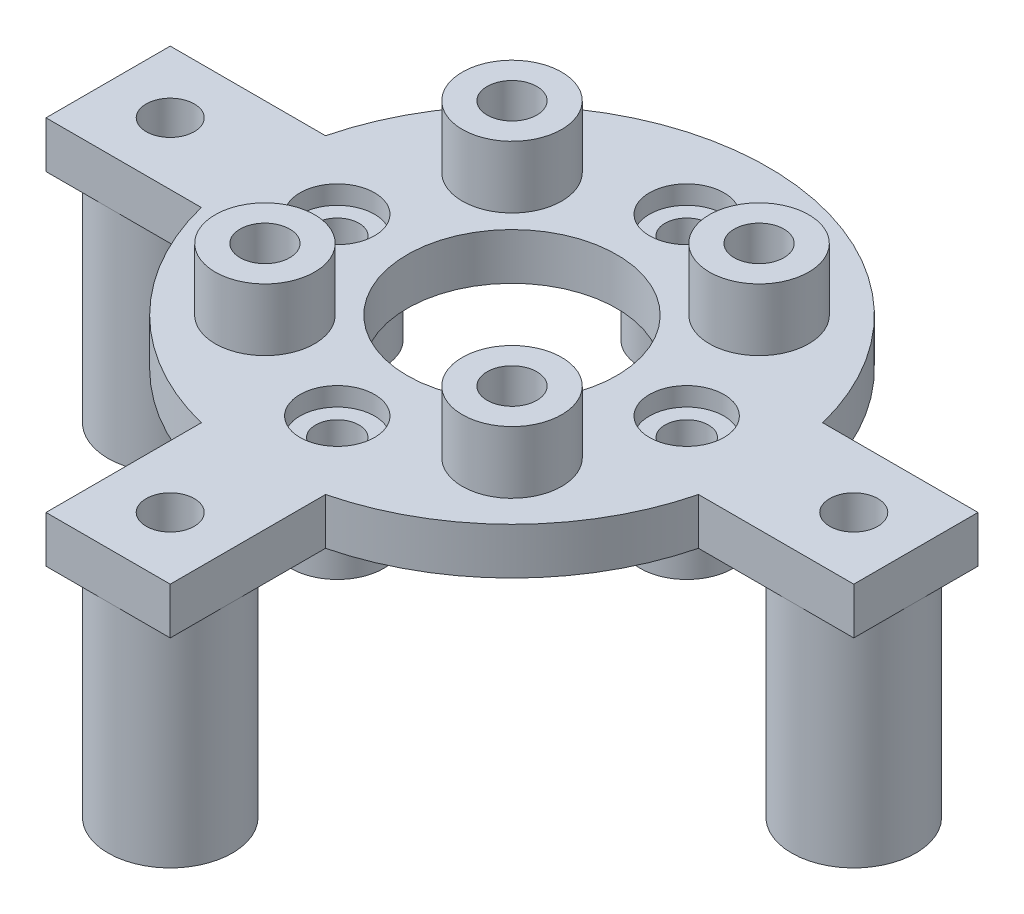
from build123d import *
from build123d.topology import SkipClean

# Parameters (mm, degrees)
SKETCH_1_R          = 16.5
SKETCH_1_R_2        = 1.4
SKETCH_1_R_3        = 6.75
EXTRUDE_1_DEPTH     = 3
SKETCH_2_R          = 3.2
EXTRUDE_2_DEPTH     = 4
SKETCH_3_R          = 1.6
CUT_EXTRUDE_3_DEPTH = 25.36185543
EXTRUDE_START       = 4
SKETCH_4_R          = 3
SKETCH_4_R_2        = 1.4
EXTRUDE_3_DEPTH     = 4
SKETCH_5_R          = 2.4
CUT_EXTRUDE_4_DEPTH = 1.2
SKETCH_6_W          = 10
SKETCH_6_H          = 8
SKETCH_6_W_2        = 8
SKETCH_6_H_2        = 10
EXTRUDE_4_DEPTH     = 3
SKETCH_7_R          = 4
EXTRUDE_5_DEPTH     = 14
SKETCH_8_R          = 1.55
CUT_EXTRUDE_5_DEPTH = 43.35342281


with BuildPart() as part:
    # 草图1 → 凸台-拉伸1 (new body)
    with BuildSketch(Plane(origin=(0, 0, 0), x_dir=(1, 0, 0), z_dir=(0, 1, 0))):
        with Locations(Location((0, 0, 0), (0, 0, 270))):
            Circle(SKETCH_1_R)
        with Locations(Location((0, 11.25, 0), (0, 0, 270))):
            Circle(SKETCH_1_R_2, mode=Mode.SUBTRACT)
        with Locations(Location((11.25, 0, 0), (0, 0, 270))):
            Circle(SKETCH_1_R_2, mode=Mode.SUBTRACT)
        with Locations(Location((0, -11.25, 0), (0, 0, 270))):
            Circle(SKETCH_1_R_2, mode=Mode.SUBTRACT)
        with Locations(Location((-11.25, 0, 0), (0, 0, 270))):
            Circle(SKETCH_1_R_2, mode=Mode.SUBTRACT)
        with Locations(Location((0, 0, 0), (0, 0, 270))):
            Circle(SKETCH_1_R_3, mode=Mode.SUBTRACT)
    extrude(amount=EXTRUDE_1_DEPTH)

    # 草图2 → 凸台-拉伸2 (add)
    with BuildSketch(Plane(origin=(0, 3, 0), x_dir=(1, 0, 0), z_dir=(0, 1, 0))):
        with Locations(Location((7.954951288, 7.954951288, 0), (0, 0, 270))):
            Circle(SKETCH_2_R)
        with Locations(Location((7.954951288, -7.954951288, 0), (0, 0, 270))):
            Circle(SKETCH_2_R)
        with Locations(Location((-7.954951288, -7.954951288, 0), (0, 0, 270))):
            Circle(SKETCH_2_R)
        with Locations(Location((-7.954951288, 7.954951288, 0), (0, 0, 270))):
            Circle(SKETCH_2_R)
    extrude(amount=EXTRUDE_2_DEPTH)

    # 草图3 → 切除-拉伸3 (cut, through all)
    with BuildSketch(Plane(origin=(0, 7, 0), x_dir=(1, 0, 0), z_dir=(0, 1, 0))):
        with Locations(Location((-7.954951288, 7.954951288, 0), (0, 0, 270))):
            Circle(SKETCH_3_R)
        with Locations(Location((7.954951288, 7.954951288, 0), (0, 0, 270))):
            Circle(SKETCH_3_R)
        with Locations(Location((-7.954951288, -7.954951288, 0), (0, 0, 270))):
            Circle(SKETCH_3_R)
        with Locations(Location((7.954951288, -7.954951288, 0), (0, 0, 270))):
            Circle(SKETCH_3_R)
    extrude(amount=-CUT_EXTRUDE_3_DEPTH, mode=Mode.SUBTRACT)

    # 草图4 → 凸台-拉伸3 (add)
    # profile 1 of 4: a face of its own
    with SkipClean():  # the faces are left unmerged after this step: merging them gives an invalid solid
        with BuildSketch(Plane.XZ.offset(EXTRUDE_START)):
            with Locations(Location((0, -11.25, 0), (0, 0, 90))):
                Circle(SKETCH_4_R)
            with Locations(Location((0, -11.25, 0), (0, 0, 270))):
                Circle(SKETCH_4_R_2, mode=Mode.SUBTRACT)
        # profile 2 of 4: a face of its own
        with BuildSketch(Plane.XZ.offset(EXTRUDE_START)):
            with Locations(Location((-11.25, 0, 0), (0, 0, 90))):
                Circle(SKETCH_4_R)
            with Locations(Location((-11.25, 0, 0), (0, 0, 270))):
                Circle(SKETCH_4_R_2, mode=Mode.SUBTRACT)
        # profile 3 of 4: a face of its own
        with BuildSketch(Plane.XZ.offset(EXTRUDE_START)):
            with Locations(Location((0, 11.25, 0), (0, 0, 90))):
                Circle(SKETCH_4_R)
            with Locations(Location((0, 11.25, 0), (0, 0, 270))):
                Circle(SKETCH_4_R_2, mode=Mode.SUBTRACT)
        # profile 4 of 4: a face of its own
        with BuildSketch(Plane.XZ.offset(EXTRUDE_START)):
            with Locations(Location((11.25, 0, 0), (0, 0, 90))):
                Circle(SKETCH_4_R)
            with Locations(Location((11.25, 0, 0), (0, 0, 270))):
                Circle(SKETCH_4_R_2, mode=Mode.SUBTRACT)
        extrude(amount=-EXTRUDE_3_DEPTH)

    # 草图5 → 切除-拉伸4 (cut)
    with BuildSketch(Plane(origin=(0, 3, 0), x_dir=(1, 0, 0), z_dir=(0, 1, 0))):
        with Locations(Location((0, 11.25, 0), (0, 0, 270))):
            Circle(SKETCH_5_R)
        with Locations(Location((11.25, 0, 0), (0, 0, 270))):
            Circle(SKETCH_5_R)
        with Locations(Location((0, -11.25, 0), (0, 0, 270))):
            Circle(SKETCH_5_R)
        with Locations(Location((-11.25, 0, 0), (0, 0, 270))):
            Circle(SKETCH_5_R)
    extrude(amount=-CUT_EXTRUDE_4_DEPTH, mode=Mode.SUBTRACT)

    # 草图6 → 凸台-拉伸4 (add)
    with BuildSketch(Plane.XZ):
        with Locations((-21.007810594, 0)):
            Rectangle(SKETCH_6_W, SKETCH_6_H)
        with Locations((0, 21.007810594)):
            Rectangle(SKETCH_6_W_2, SKETCH_6_H_2)
        with Locations((21.007810594, 0)):
            Rectangle(SKETCH_6_W, SKETCH_6_H)
    extrude(amount=-EXTRUDE_4_DEPTH)

    # 草图7 → 凸台-拉伸5 (add)
    with BuildSketch(Plane(origin=(0, 0, 0), x_dir=(1, 0, 0), z_dir=(0, 1, 0))):
        with Locations(Location((-22.007810594, 0, 0), (0, 0, 270))):
            Circle(SKETCH_7_R)
        with Locations(Location((0, -22.007810594, 0), (0, 0, 270))):
            Circle(SKETCH_7_R)
        with Locations(Location((22.007810594, 0, 0), (0, 0, 270))):
            Circle(SKETCH_7_R)
    extrude(amount=-EXTRUDE_5_DEPTH)

    # 草图8 → 切除-拉伸5 (cut, through all)
    with BuildSketch(Plane.XZ.offset(14)):
        with Locations(Location((-22.007810594, 0, 0), (0, 0, 270))):
            Circle(SKETCH_8_R)
        with Locations(Location((0, 22.007810594, 0), (0, 0, 270))):
            Circle(SKETCH_8_R)
        with Locations(Location((22.007810594, 0, 0), (0, 0, 270))):
            Circle(SKETCH_8_R)
    extrude(amount=-CUT_EXTRUDE_5_DEPTH, mode=Mode.SUBTRACT)


solid = part.part
